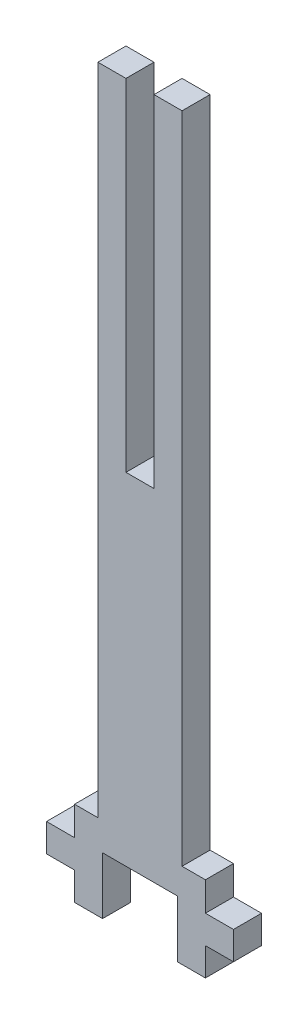
from build123d import *

# Parameters (mm, degrees)
EXTRUDE_1_DEPTH     = 3
SKETCH_2_W          = 3
SKETCH_2_H          = 36.495999937
CUT_EXTRUDE_1_DEPTH = 3
SKETCH_3_W          = 3
SKETCH_3_H          = 3
EXTRUDE_2_DEPTH     = 3


with BuildPart() as part:
    # 스케치1 → 보스-돌출1 (new body)
    with BuildSketch(Plane.XY):
        Polygon((-4.5, 39.545999937), (4.5, 39.545999937), (4.5, -30.445999937), (7, -30.445999937), (7, -39.545999937), (4, -39.545999937), (4, -33.445999937), (-4, -33.445999937), (-4, -39.545999937), (-7, -39.545999937), (-7, -30.445999937), (-4.5, -30.445999937), align=None)
    extrude(amount=EXTRUDE_1_DEPTH)

    # 스케치2 → 컷-돌출1 (cut)
    with BuildSketch(Plane.XY.offset(3)):
        with Locations((0, 21.297999969)):
            Rectangle(SKETCH_2_W, SKETCH_2_H)
    extrude(amount=-CUT_EXTRUDE_1_DEPTH, mode=Mode.SUBTRACT)

    # 스케치3 → 보스-돌출2 (add)
    with BuildSketch(Plane.XY.offset(3)):
        with Locations((-8.5, -35.045999937)):
            Rectangle(SKETCH_3_W, SKETCH_3_H)
        with Locations((8.5, -35.045999937)):
            Rectangle(SKETCH_3_W, SKETCH_3_H)
    extrude(amount=-EXTRUDE_2_DEPTH)


solid = part.part
